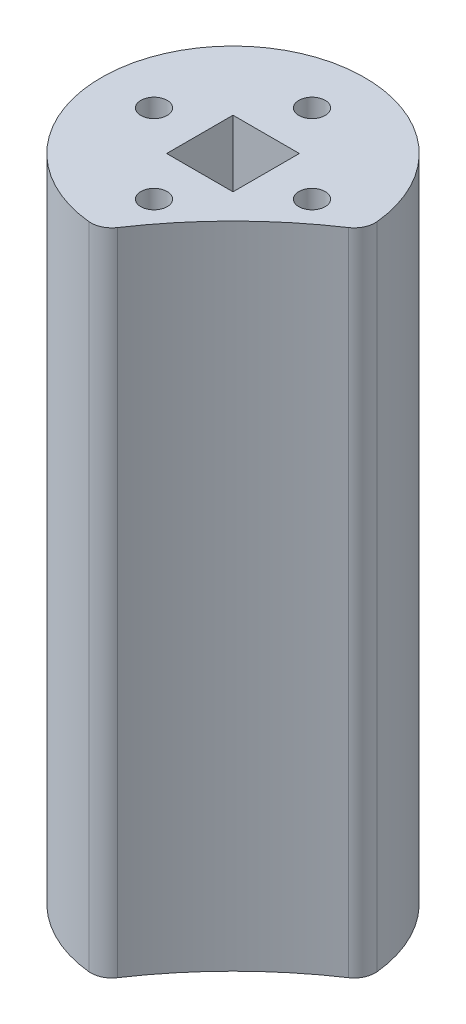
from build123d import *

# Parameters (mm, degrees)
SKETCH1_W                   = 6.3
SKETCH1_H                   = 6.3
BOSS_EXTRUDE1_DEPTH         = 61.675
TAP_DRILL_FOR_M3X0_5_TAP1_D = 2.5
FILLET1_R                   = 2


with BuildPart() as part:
    # Sketch1 → Boss-Extrude1 (new body)
    with BuildSketch(Plane(origin=(0, 0, 0), x_dir=(1, 0, 0), z_dir=(0, 1, 0))):
        with BuildLine():
            ThreePointArc((0, -12.5), (5.550824366, -5.550824366), (12.5, 0))
            ThreePointArc((12.5, 0), (-8.838834765, 8.838834765), (0, -12.5))
        make_face()
        Rectangle(SKETCH1_W, SKETCH1_H, mode=Mode.SUBTRACT)
    extrude(amount=-BOSS_EXTRUDE1_DEPTH)

    # Tap Drill for M3x0.5 Tap1 (through all)
    with Locations(Plane(origin=(0, 0, -7.5), x_dir=(0, 0, 1), z_dir=(0, 1, 0))):
        with Locations((0, 0), (7.5, 7.5), (7.5, -7.5), (15, 0)):
            Hole(TAP_DRILL_FOR_M3X0_5_TAP1_D / 2)

    # Fillet1
    fillet1_edges = [part.edges().sort_by_distance(p)[0] for p in [
        (0, -30.8375, 12.5),
        (12.5, -30.8375, 0),
    ]]
    fillet(fillet1_edges, radius=FILLET1_R)


solid = part.part
